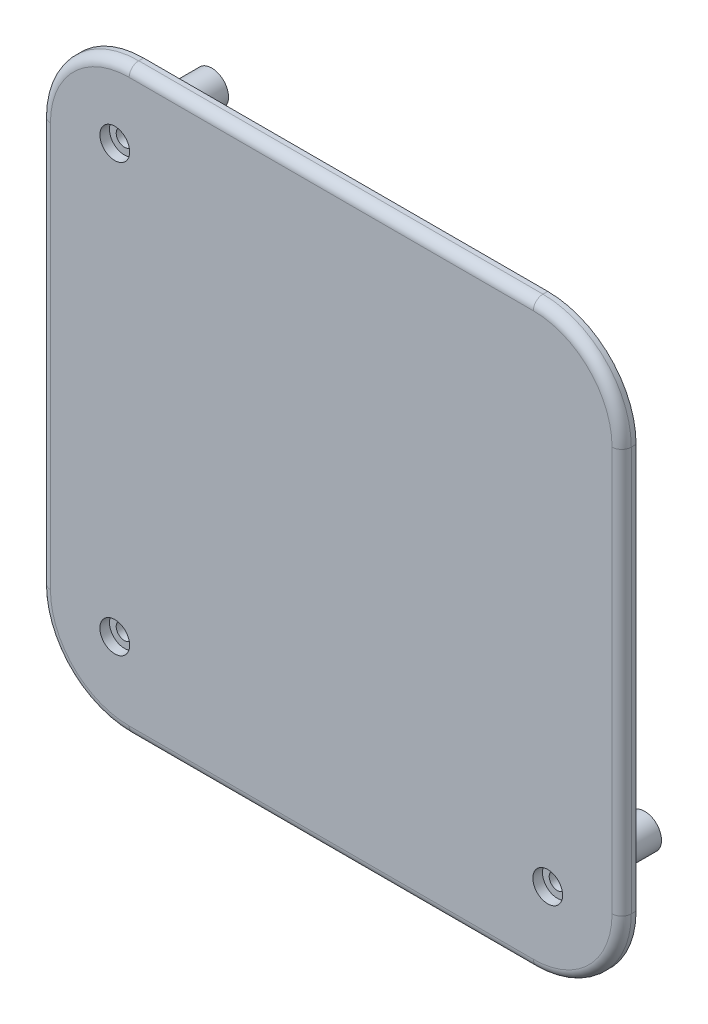
from build123d import *

# Parameters (mm, degrees)
EXTRUDE_1_DEPTH     = 1.5
SKETCH_2_R          = 0.85
CUT_EXTRUDE_1_DEPTH = 11
SKETCH_4_R          = 0.85
CUT_EXTRUDE_2_DEPTH = 11.5
SKETCH_5_R          = 0.85
CUT_EXTRUDE_3_DEPTH = 11.5
SKETCH_9_R          = 1.55
SKETCH_9_R_2        = 0.85
CUT_EXTRUDE_5_DEPTH = 1
SKETCH_8_R          = 1.75
SKETCH_8_R_2        = 0.85
EXTRUDE_6_DEPTH     = 8.6
FILLET_2_R          = 1


with BuildPart() as part:
    # 草图1 → 凸台-拉伸1 (new body)
    with BuildSketch(Plane.XY):
        with BuildLine():
            Line((-26.273021583, 44.286870504), (15.826978417, 44.286870504))
            ThreePointArc((15.826978417, 44.286870504), (22.332360804, 41.592252891), (25.026978417, 35.086870504))
            Line((25.026978417, 35.086870504), (25.026978417, -7.013129496))
            ThreePointArc((25.026978417, -7.013129496), (22.332360804, -13.518511883), (15.826978417, -16.213129496))
            Line((15.826978417, -16.213129496), (-26.273021583, -16.213129496))
            ThreePointArc((-26.273021583, -16.213129496), (-32.77840397, -13.518511883), (-35.473021583, -7.013129496))
            Line((-35.473021583, -7.013129496), (-35.473021583, 35.086870504))
            ThreePointArc((-35.473021583, 35.086870504), (-32.77840397, 41.592252891), (-26.273021583, 44.286870504))
        make_face()
    extrude(amount=EXTRUDE_1_DEPTH)

    # 草图2 → 切除-拉伸1 (cut)
    with BuildSketch(Plane.XY.offset(1.5)):
        with Locations((-27.773021583, 36.586870504)):
            Circle(SKETCH_2_R)
    extrude(amount=-CUT_EXTRUDE_1_DEPTH, mode=Mode.SUBTRACT)

    # 草图4 → 切除-拉伸2 (cut)
    with BuildSketch(Plane.XY.offset(1.5)):
        with Locations((-27.773021583, -7.913129496)):
            Circle(SKETCH_4_R)
    extrude(amount=-CUT_EXTRUDE_2_DEPTH, mode=Mode.SUBTRACT)

    # 草图5 → 切除-拉伸3 (cut)
    with BuildSketch(Plane.XY.offset(1.5)):
        with Locations((17.326978417, -7.913129496)):
            Circle(SKETCH_5_R)
    extrude(amount=-CUT_EXTRUDE_3_DEPTH, mode=Mode.SUBTRACT)

    # 草图9 → 切除-拉伸5 (cut)
    # profile 1 of 3: a face of its own
    with BuildSketch(Plane.XY.offset(1.5)):
        with Locations((-27.773021583, 36.586870504)):
            Circle(SKETCH_9_R)
        with Locations((-27.773021583, 36.586870504)):
            Circle(SKETCH_9_R_2, mode=Mode.SUBTRACT)
    # profile 2 of 3: a face of its own
    with BuildSketch(Plane.XY.offset(1.5)):
        with Locations((-27.773021583, -7.913129496)):
            Circle(SKETCH_9_R)
        with Locations((-27.773021583, -7.913129496)):
            Circle(SKETCH_9_R_2, mode=Mode.SUBTRACT)
    # profile 3 of 3: a face of its own
    with BuildSketch(Plane.XY.offset(1.5)):
        with Locations((17.326978417, -7.913129496)):
            Circle(SKETCH_9_R)
        with Locations((17.326978417, -7.913129496)):
            Circle(SKETCH_9_R_2, mode=Mode.SUBTRACT)
    extrude(amount=-CUT_EXTRUDE_5_DEPTH, mode=Mode.SUBTRACT)

    # 草图8 → 凸台-拉伸6 (add)
    # profile 1 of 3: a face of its own
    with BuildSketch(Plane(origin=(0, 0, 0), x_dir=(-1, 0, 0), z_dir=(0, 0, -1))):
        with Locations(Location((27.773021583, 36.586870504, 0), (0, 0, 180))):
            Circle(SKETCH_8_R)
        with Locations(Location((27.773021583, 36.586870504, 0), (0, 0, 180))):
            Circle(SKETCH_8_R_2, mode=Mode.SUBTRACT)
    # profile 2 of 3: a face of its own
    with BuildSketch(Plane(origin=(0, 0, 0), x_dir=(-1, 0, 0), z_dir=(0, 0, -1))):
        with Locations(Location((27.773021583, -7.913129496, 0), (0, 0, 180))):
            Circle(SKETCH_8_R)
        with Locations(Location((27.773021583, -7.913129496, 0), (0, 0, 180))):
            Circle(SKETCH_8_R_2, mode=Mode.SUBTRACT)
    # profile 3 of 3: a face of its own
    with BuildSketch(Plane(origin=(0, 0, 0), x_dir=(-1, 0, 0), z_dir=(0, 0, -1))):
        with Locations(Location((-17.326978417, -7.913129496, 0), (0, 0, 180))):
            Circle(SKETCH_8_R)
        with Locations(Location((-17.326978417, -7.913129496, 0), (0, 0, 180))):
            Circle(SKETCH_8_R_2, mode=Mode.SUBTRACT)
    extrude(amount=EXTRUDE_6_DEPTH)

    # 圆角2
    fillet_2_edges = [part.edges().sort_by_distance(p)[0] for p in [
        (22.332360804, -13.518511883, 1.5),
        (25.026978417, 14.036870504, 1.5),
        (22.332360804, 41.592252891, 1.5),
        (-5.223021583, 44.286870504, 1.5),
        (-32.77840397, 41.592252891, 1.5),
        (-35.473021583, 14.036870504, 1.5),
        (-32.77840397, -13.518511883, 1.5),
        (-5.223021583, -16.213129496, 1.5),
    ]]
    fillet(fillet_2_edges, radius=FILLET_2_R)


solid = part.part
